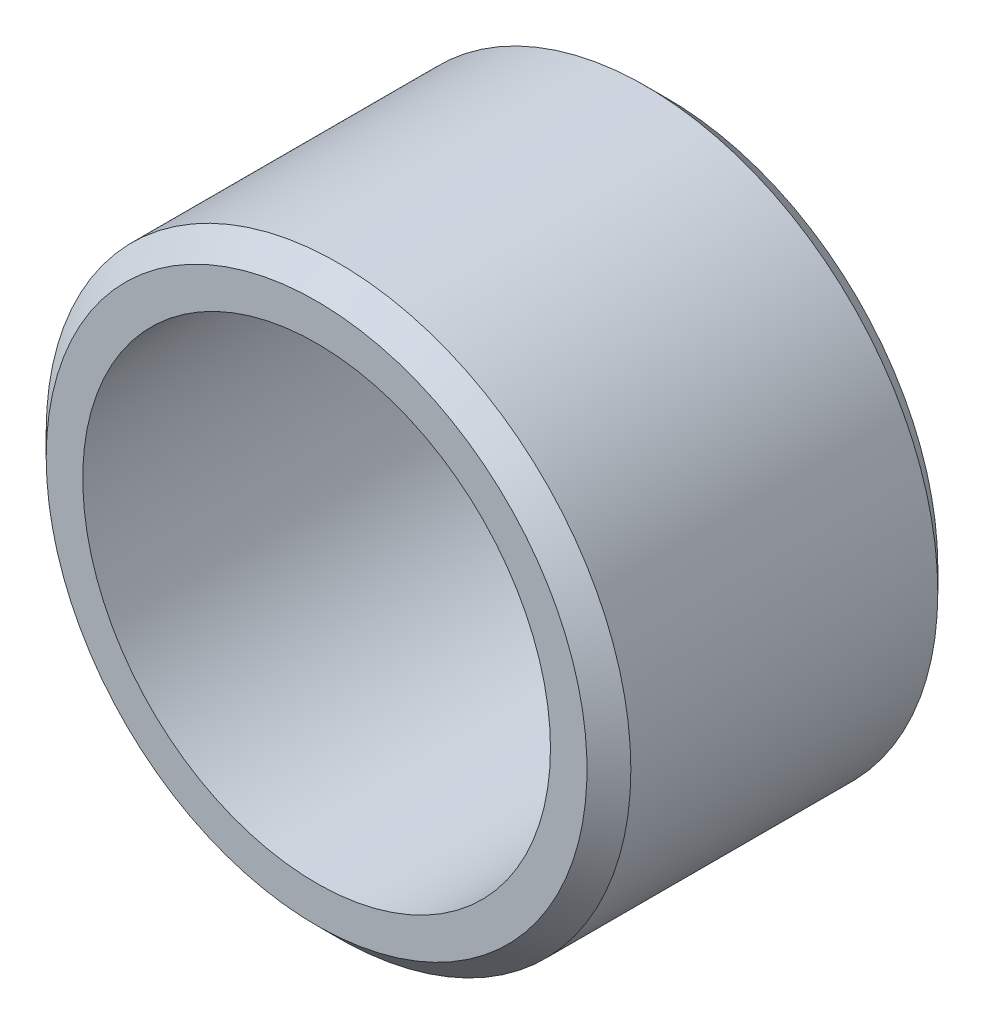
from build123d import *

# Parameters (mm, degrees)
SKETCH3_W     = 9.525
SKETCH3_H     = 1.5875
CHAMFER1_SIZE = 0.5953125


with BuildPart() as part:
    # Sketch3 → Revolve1 (revolve)
    with BuildSketch(Plane(origin=(0, 0, 0), x_dir=(0, 0, -1), z_dir=(1, 0, 0)), mode=Mode.PRIVATE) as revolve1_sk:
        with Locations((0, 7.14375)):
            Rectangle(SKETCH3_W, SKETCH3_H)
    revolve(revolve1_sk.sketch.rotate(Axis((0, 0, 4.7625), (0, 0, -1)), 90), axis=Axis((0, 0, 4.7625), (0, 0, -1)))

    # Chamfer1
    chamfer1_edges = [part.edges().sort_by_distance(p)[0] for p in [
        (-7.9375, 0, 4.7625),
        (-7.9375, 0, -4.7625),
    ]]
    chamfer(chamfer1_edges, length=CHAMFER1_SIZE)


solid = part.part
